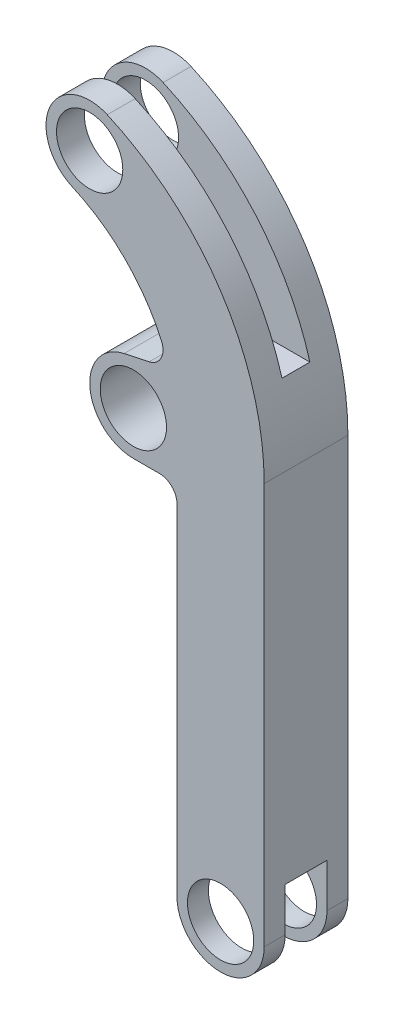
from build123d import *

# Parameters (mm, degrees)
CROQUIS2_R                 = 12.5
CROQUIS2_R_2               = 9.5
SALIENTE_EXTRUIR1_DEPTH    = 24
CORTAR_EXTRUIR3_DEPTH      = 191.437747955
CORTAR_EXTRUIR3_DEPTH_BACK = 191.437747955
CROQUIS5_W                 = 8
CROQUIS5_H                 = 49.434743854
CORTAR_EXTRUIR4_DEPTH      = 191.437747955
CORTAR_EXTRUIR4_DEPTH_BACK = 191.437747955
CROQUIS6_W                 = 12
CROQUIS6_H                 = 25
CORTAR_EXTRUIR5_DEPTH      = 159.265939688
CORTAR_EXTRUIR5_DEPTH_BACK = 159.265939688
CROQUIS7_W                 = 14.533349016
CROQUIS7_H                 = 8


with BuildPart() as part:
    # Croquis2 → Saliente-Extruir1 (new body)
    # profile 1 of 4: a face of its own
    with BuildSketch(Plane.XY):
        with Locations((-37.533349016, 172.653405471)):
            Circle(CROQUIS2_R)
        with Locations((-37.533349016, 172.653405471)):
            Circle(CROQUIS2_R_2, mode=Mode.SUBTRACT)
    # profile 2 of 4: a face of its own
    with BuildSketch(Plane.XY):
        with BuildLine():
            Line((-12.5, 58.855421297), (-12.5, 0))
            ThreePointArc((-12.5, 0), (0, 12.5), (12.5, 0))
            Line((12.5, 0), (12.5, 115))
            ThreePointArc((12.5, 115), (0.265693313, 156.217157525), (-32.475079629, 184.08423706))
            ThreePointArc((-32.475079629, 184.08423706), (-27.057701844, 179.473289366), (-25.033349016, 172.653405471))
            ThreePointArc((-25.033349016, 172.653405471), (-30.713465121, 162.1777583), (-42.591618403, 161.222573883))
            ThreePointArc((-42.591618403, 161.222573883), (-27.406897086, 150.843693068), (-16.941222141, 135.718661617))
            ThreePointArc((-16.941222141, 135.718661617), (-17.037727548, 131.417260647), (-20.439743892, 128.783319041))
            Line((-20.439743892, 128.783319041), (-27.655370554, 127.214704549))
            ThreePointArc((-27.655370554, 127.214704549), (-17.155961879, 124.732474812), (-12.5, 115))
            ThreePointArc((-12.5, 115), (-16.161165235, 106.161165235), (-25, 102.5))
            Line((-25, 102.5), (-17.5, 102.5))
            ThreePointArc((-17.5, 102.5), (-13.964466094, 101.035533906), (-12.5, 97.5))
            Line((-12.5, 97.5), (-12.5, 58.855421297))
        make_face()
    # profile 3 of 4: a face of its own
    with BuildSketch(Plane.XY):
        with Locations((-25, 115)):
            Circle(CROQUIS2_R)
        with Locations((-25, 115)):
            Circle(CROQUIS2_R_2, mode=Mode.SUBTRACT)
    # profile 4 of 4: a face of its own
    with BuildSketch(Plane.XY):
        Circle(CROQUIS2_R)
        Circle(CROQUIS2_R_2, mode=Mode.SUBTRACT)
    extrude(amount=SALIENTE_EXTRUIR1_DEPTH)

    # Croquis5 → Cortar-Extruir3 (cut, two sides: drawn at the far end of the back side and taken through both)
    with BuildSketch(Plane.ZY.offset(12.5).offset(-CORTAR_EXTRUIR3_DEPTH_BACK)):
        with Locations((12, 160.436033544)):
            Rectangle(CROQUIS5_W, CROQUIS5_H)
    extrude(amount=CORTAR_EXTRUIR3_DEPTH + CORTAR_EXTRUIR3_DEPTH_BACK, mode=Mode.SUBTRACT)

    # Croquis6 → Cortar-Extruir4 (cut, two sides: drawn at the far end of the back side and taken through both)
    with BuildSketch(Plane.ZY.offset(12.5).offset(-CORTAR_EXTRUIR4_DEPTH_BACK)):
        with Locations((12, 0)):
            Rectangle(CROQUIS6_W, CROQUIS6_H)
    extrude(amount=CORTAR_EXTRUIR4_DEPTH + CORTAR_EXTRUIR4_DEPTH_BACK, mode=Mode.SUBTRACT)

    # Croquis7 → Cortar-Extruir5 (cut, two sides: drawn at the far end of the back side and taken through both)
    with BuildSketch(Plane(origin=(0, 135.718661617, 0), x_dir=(1, 0, 0), z_dir=(0, 1, 0)).offset(-CORTAR_EXTRUIR5_DEPTH_BACK)):
        with Locations((-42.766674508, -12)):
            Rectangle(CROQUIS7_W, CROQUIS7_H)
    extrude(amount=CORTAR_EXTRUIR5_DEPTH + CORTAR_EXTRUIR5_DEPTH_BACK, mode=Mode.SUBTRACT)


solid = part.part
